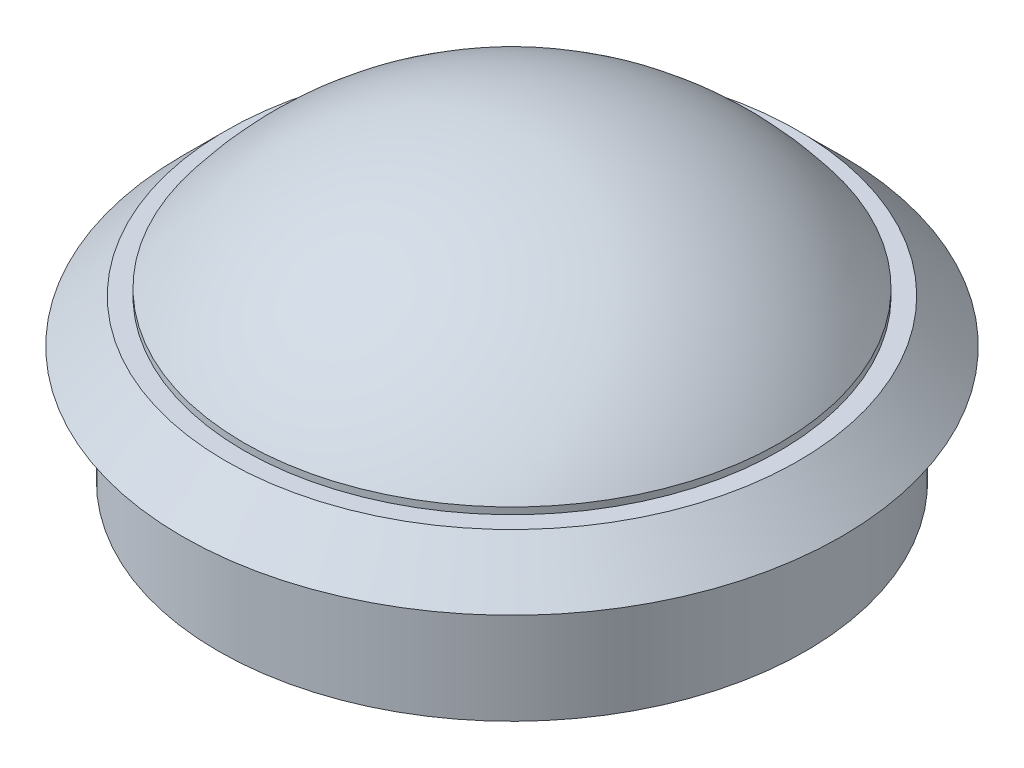
from build123d import *


with BuildPart() as part:
    # Sketch1 → Revolve1 (revolve)
    with BuildSketch(Plane.XY, mode=Mode.PRIVATE) as revolve1_sk:
        with BuildLine():
            Line((-43.9, 0), (-43.9, 17.5))
            Line((-43.9, 17.5), (-49.25, 17.5))
            Line((-49.25, 17.5), (-42.75, 24))
            Line((-42.75, 24), (-40.04076822, 24))
            Line((-40.04076822, 24), (-40.04076822, 25))
            ThreePointArc((-40.04076822, 25), (-22.378913734, 39.721866901), (0, 45))
            Line((0, 45), (0, 0))
            Line((0, 0), (-43.9, 0))
        make_face()
    revolve(revolve1_sk.sketch.rotate(Axis((0, 50.070952166, 0), (0, -1, 0)), 270), axis=Axis((0, 50.070952166, 0), (0, -1, 0)))


solid = part.part
